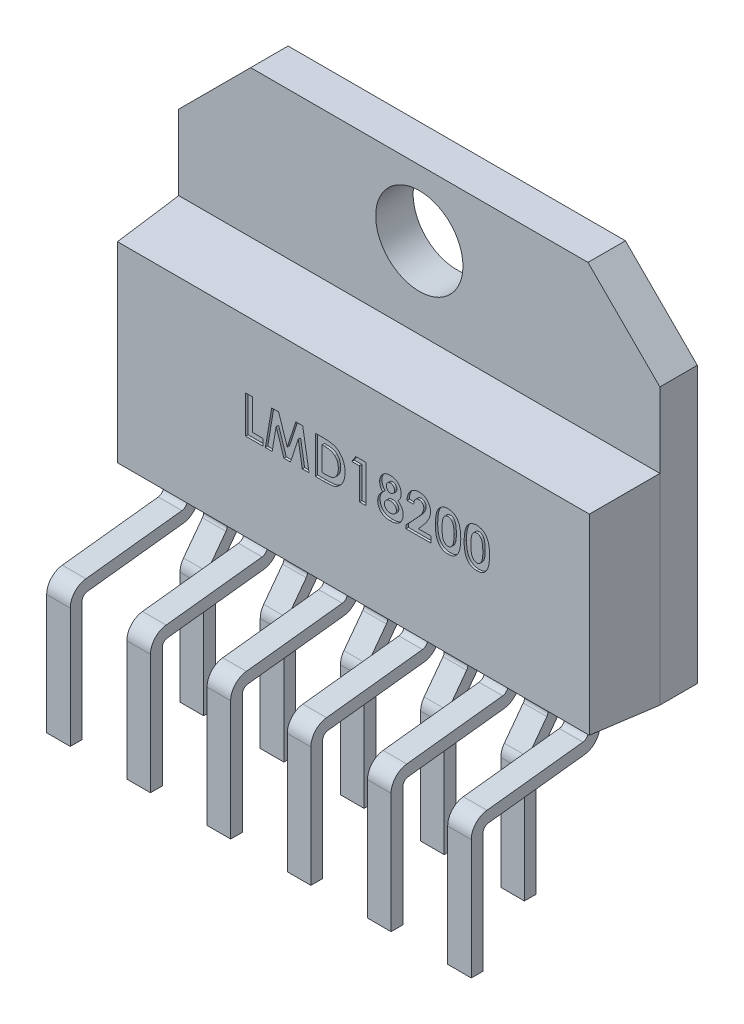
from build123d import *

# Parameters (mm, degrees)
SKETCH1_W          = 1.5875
SKETCH1_H          = 14.732
EXTRUDE2_DEPTH     = 10.1981
SKETCH4_R          = 1.85
CUT_EXTRUDE3_DEPTH = 16.783940061
CHAMFER2_SIZE      = 3.048
SKETCH5_W          = 20.3962
SKETCH5_H          = 8.509
EXTRUDE3_DEPTH     = 2.794
EXTRUDE3_TAPER     = 4
SKETCH6_W          = 1
SKETCH6_H          = 0.5
LPATTERN1_COUNT    = 6
LPATTERN1_PITCH    = 3.4
SKETCH9_W          = 1
SKETCH9_H          = 0.5
LPATTERN2_COUNT    = 5
LPATTERN2_PITCH    = 3.4
SKETCH12_R         = 0.217057399
EXTRUDE4_DEPTH     = 2.54
CUT_EXTRUDE4_DEPTH = 0.1


with BuildPart() as part:
    # Sketch1 → Extrude2 (new, symmetric)
    with BuildSketch(Plane(origin=(0, 0, 0), x_dir=(0, 0, -1), z_dir=(1, 0, 0))):
        with Locations((-0.79375, -4.576)):
            Rectangle(SKETCH1_W, SKETCH1_H)
    extrude(amount=EXTRUDE2_DEPTH, both=True)

    # Sketch4 → Cut-Extrude3 (cut, through all)
    with BuildSketch(Plane.XY.offset(1.5875)):
        Circle(SKETCH4_R)
    extrude(amount=-CUT_EXTRUDE3_DEPTH, mode=Mode.SUBTRACT)

    # Chamfer2
    chamfer2_edges = [part.edges().sort_by_distance(p)[0] for p in [
        (10.1981, 2.79, 0.79375),
        (-10.1981, 2.79, 0.79375),
    ]]
    chamfer(chamfer2_edges, length=CHAMFER2_SIZE)

    # Sketch5 → Extrude3 (add)
    with BuildSketch(Plane.XY.offset(1.5875)):
        with Locations((0, -7.6875)):
            Rectangle(SKETCH5_W, SKETCH5_H)
    extrude(amount=EXTRUDE3_DEPTH, taper=EXTRUDE3_TAPER)

    # Sweep1: sweep along a path in Sketch8
    with BuildLine(Plane(origin=(8.6081, 0, 0), x_dir=(0, 0, -1), z_dir=(1, 0, 0))) as sweep1_path:
        Line((-3.29, -11.43), (-3.29, -12.508264466))
        ThreePointArc((-3.29, -12.508264466), (-3.416774273, -12.840984403), (-3.732810227, -13.004983028))
        Line((-3.732810227, -13.004983028), (-7.800189773, -13.473281438))
        ThreePointArc((-7.800189773, -13.473281438), (-8.116225727, -13.637280063), (-8.243, -13.97))
        Line((-8.243, -13.97), (-8.243, -19.05))
    # Sketch6 → Sweep1 (sweep)
    with BuildSketch(Plane(origin=(0, -11.43, 0), x_dir=(-1, 0, 0), z_dir=(0, 1, 0))):
        with Locations((-8.6081, 3.29)):
            Rectangle(SKETCH6_W, SKETCH6_H)
    sweep1 = sweep(path=sweep1_path.line)

    # LPattern1: Sweep1 ×6
    with Locations(*[(-i * LPATTERN1_PITCH, 0, 0) for i in range(1, LPATTERN1_COUNT)]):
        add(sweep1)

    # Sweep2: sweep along a path in Sketch10
    with BuildLine(Plane(origin=(6.9081, 0, 0), x_dir=(0, 0, -1), z_dir=(1, 0, 0))) as sweep2_path:
        Line((-3.29, -11.43), (-3.29, -12.605732128))
        ThreePointArc((-3.29, -12.605732128), (-3.315412654, -12.763107003), (-3.389067405, -12.904484625))
        Line((-3.389067405, -12.904484625), (-4.190932595, -13.980605812))
        ThreePointArc((-4.190932595, -13.980605812), (-4.264587346, -14.121983434), (-4.29, -14.279358308))
        Line((-4.29, -14.279358308), (-4.29, -19.05))
    # Sketch9 → Sweep2 (sweep)
    with BuildSketch(Plane(origin=(0, -11.43, 0), x_dir=(-1, 0, 0), z_dir=(0, 1, 0))):
        with Locations((-6.9081, 3.29)):
            Rectangle(SKETCH9_W, SKETCH9_H)
    sweep2 = sweep(path=sweep2_path.line)

    # LPattern2: Sweep2 ×5
    with Locations(*[(-i * LPATTERN2_PITCH, 0, 0) for i in range(1, LPATTERN2_COUNT)]):
        add(sweep2)

    # Sketch12 → Extrude4 (cut)
    with BuildSketch(Plane.XZ.offset(19.05)):
        with Locations(Location((0.1081, 4.29, 0), (0, 0, 270))):
            Circle(SKETCH12_R)
    extrude(amount=-EXTRUDE4_DEPTH, mode=Mode.SUBTRACT)

    # Sketch11 → Cut-Extrude4 (cut)
    # profile 1 of 8: a face of its own
    with BuildSketch(Plane.XY.offset(4.3815)):
        Polygon((-4.566807575, -6.464375318), (-4.281871678, -6.464375318), (-4.281871678, -7.766939421), (-3.834115268, -7.766939421), (-3.834115268, -8.051875318), (-4.566807575, -8.051875318), align=None)
    # profile 2 of 8: a face of its own
    with BuildSketch(Plane.XY.offset(4.3815)):
        Polygon((-3.464271017, -6.464375318), (-3.16852282, -6.464375318), (-2.80631078, -7.571682009), (-2.441554671, -6.464375318), (-2.148668553, -6.464375318), (-1.880269114, -8.051875318), (-2.168703108, -8.051875318), (-2.338201806, -7.049193527), (-2.668294955, -8.051875318), (-2.946234659, -8.051875318), (-3.274419755, -7.049193527), (-3.443600444, -8.051875318), (-3.732352447, -8.051875318), align=None)
    # profile 3 of 8: a face of its own
    with BuildSketch(Plane.XY.offset(4.3815)):
        with BuildLine():
            Line((-1.61568578, -6.464375318), (-1.256653829, -6.464375318))
            add(Edge.make_bspline(
                [(-1.256653829, -6.464375318), (-1.228663159, -6.464570983), (-1.174556877, -6.464949204), (-1.096167579, -6.46921085), (-1.023275506, -6.475764959), (-0.955833672, -6.484781323), (-0.893980343, -6.496712443), (-0.837795278, -6.511677694), (-0.787089906, -6.528952586), (-0.741308254, -6.549280002), (-0.699514008, -6.572979751), (-0.659829038, -6.599379368), (-0.622331264, -6.629445949), (-0.586494465, -6.66259945), (-0.55278112, -6.699446403), (-0.520629784, -6.73937649), (-0.490827665, -6.782968752), (-0.462473912, -6.829177983), (-0.436831714, -6.878200015), (-0.414465632, -6.929617582), (-0.395729428, -6.983099793), (-0.380505293, -7.038703645), (-0.3683699, -7.096244552), (-0.359879011, -7.155838625), (-0.354629858, -7.217430689), (-0.354097375, -7.259174656), (-0.353826806, -7.280385935)],
                knots=[0, 0, 0, 0, 1.44355588, 2.790409838, 4.047694926, 5.217575253, 6.298404546, 7.294384826, 8.214239204, 9.058592145, 9.873746385, 10.689560431, 11.514393297, 12.350027578, 13.205127629, 14.088021785, 14.991911688, 15.926770944, 16.882954281, 17.842803888, 18.816321264, 19.80318086, 20.814351908, 21.847355356, 22.906180909, 24, 24, 24, 24], degree=3))
            add(Edge.make_bspline(
                [(-0.353826806, -7.280385935), (-0.354535303, -7.310316431), (-0.35593002, -7.369236365), (-0.367678338, -7.455700689), (-0.386679346, -7.538585367), (-0.413396489, -7.617242044), (-0.446518595, -7.690970269), (-0.48608666, -7.758469878), (-0.531520522, -7.819378565), (-0.582290877, -7.873393055), (-0.637262805, -7.919819242), (-0.694389724, -7.959579874), (-0.754228154, -7.99093445), (-0.806954173, -8.010817939), (-0.85267421, -8.02318375), (-0.892815907, -8.030492063), (-0.93841278, -8.037194227), (-0.989889979, -8.042373515), (-1.047021685, -8.046992167), (-1.110035625, -8.049501763), (-1.178727779, -8.051586864), (-1.226440975, -8.051776647), (-1.251247679, -8.051875318)],
                knots=[0, 0, 0, 0, 1.315458931, 2.589557908, 3.828601765, 5.048913369, 6.235739168, 7.376350998, 8.481830359, 9.569842114, 10.627874879, 11.640079404, 12.624025415, 13.590060155, 14.111227486, 14.704434459, 15.382649715, 16.137166398, 16.978595427, 17.902333227, 18.909396075, 20, 20, 20, 20], degree=3))
            Line((-1.251247679, -8.051875318), (-1.61568578, -8.051875318))
            Line((-1.61568578, -8.051875318), (-1.61568578, -6.464375318))
        make_face()
        with BuildLine():
            Line((-1.330749883, -6.749311216), (-1.330749883, -7.766939421))
            Line((-1.330749883, -7.766939421), (-1.181921758, -7.766939421))
            add(Edge.make_bspline(
                [(-1.181921758, -7.766939421), (-1.164213497, -7.766906972), (-1.130154615, -7.766844562), (-1.0809813, -7.763871921), (-1.035508452, -7.76088821), (-0.993861246, -7.755225025), (-0.955736589, -7.748916636), (-0.921658212, -7.740137649), (-0.890923612, -7.730916067), (-0.863908206, -7.71917585), (-0.839164296, -7.705961454), (-0.816254261, -7.690479257), (-0.794139663, -7.673286862), (-0.773233953, -7.653878615), (-0.753458006, -7.632511518), (-0.734928831, -7.609075476), (-0.717399111, -7.583641993), (-0.701318801, -7.556076595), (-0.686624528, -7.526670381), (-0.673589062, -7.49570819), (-0.662780736, -7.462932177), (-0.653797518, -7.428649162), (-0.64737799, -7.392560674), (-0.642067055, -7.354934015), (-0.639329113, -7.315620112), (-0.638953347, -7.288869618), (-0.638762703, -7.275297794)],
                knots=[0, 0, 0, 0, 1.50275155, 2.890291501, 4.180787663, 5.369391935, 6.45668281, 7.458360028, 8.354766181, 9.177074746, 9.954075863, 10.732690366, 11.5210699, 12.329727389, 13.151100085, 13.990027547, 14.863562427, 15.770965086, 16.696477834, 17.652329173, 18.619756807, 19.62365428, 20.657822005, 21.729286259, 22.847956731, 24, 24, 24, 24], degree=3))
            add(Edge.make_bspline(
                [(-0.638762703, -7.275297794), (-0.639142402, -7.254500258), (-0.639882784, -7.213946672), (-0.647022868, -7.154879491), (-0.658645564, -7.09925889), (-0.675230032, -7.047291294), (-0.696135267, -6.998830647), (-0.722303041, -6.954287512), (-0.752607195, -6.912913626), (-0.776570894, -6.888642377), (-0.788544855, -6.876514741)],
                knots=[0, 0, 0, 0, 1.13821349, 2.219428113, 3.251817212, 4.244760574, 5.201143372, 6.134805572, 7.068016741, 8, 8, 8, 8], degree=3))
            add(Edge.make_bspline(
                [(-0.788544855, -6.876514741), (-0.800352314, -6.866180357), (-0.824467713, -6.845073546), (-0.866806429, -6.819782189), (-0.913461502, -6.797561253), (-0.965500258, -6.779942529), (-1.022419768, -6.76600889), (-1.084559044, -6.756399201), (-1.151585318, -6.750224116), (-1.198019559, -6.749622035), (-1.221990868, -6.749311216)],
                knots=[0, 0, 0, 0, 0.813307809, 1.661089106, 2.549956539, 3.493439533, 4.508053171, 5.589449661, 6.755572447, 8, 8, 8, 8], degree=3))
            Line((-1.221990868, -6.749311216), (-1.330749883, -6.749311216))
        make_face(mode=Mode.SUBTRACT)
    # profile 4 of 8: a face of its own
    with BuildSketch(Plane.XY.offset(4.3815)):
        Polygon((0.101243807, -6.464375318), (0.541686015, -6.464375318), (0.541686015, -8.051875318), (0.256750117, -8.051875318), (0.256750117, -6.728958652), (-0.068890909, -6.728958652), align=None)
    # profile 5 of 8: a face of its own
    with BuildSketch(Plane.XY.offset(4.3815)):
        with BuildLine():
            add(Edge.make_bspline(
                [(1.891315422, -7.197067626), (1.907962359, -7.208962312), (1.940913469, -7.23250677), (1.984429831, -7.274687548), (2.021912591, -7.321740694), (2.052968137, -7.373377595), (2.077848904, -7.428329002), (2.095659758, -7.48600755), (2.106973009, -7.5459045), (2.108208753, -7.586684014), (2.10883345, -7.607298996)],
                knots=[0, 0, 0, 0, 1.013736912, 2.006600758, 2.994453809, 3.989973287, 4.987781207, 5.978959008, 6.978317308, 8, 8, 8, 8], degree=3))
            add(Edge.make_bspline(
                [(2.10883345, -7.607298996), (2.108079801, -7.629621393), (2.106585033, -7.673895003), (2.09336929, -7.738822244), (2.072151945, -7.801198598), (2.043154302, -7.860335588), (2.006796591, -7.914395461), (1.964418297, -7.962253855), (1.915966, -8.002660865), (1.870855539, -8.030076761), (1.832027389, -8.048288622), (1.800693413, -8.059943848), (1.767606794, -8.070204643), (1.73253143, -8.078402338), (1.6954737, -8.084801984), (1.656486489, -8.089028298), (1.615544134, -8.092100571), (1.587623178, -8.092417791), (1.573306607, -8.092580446)],
                knots=[0, 0, 0, 0, 1.313679292, 2.605514271, 3.884962679, 5.186178731, 6.472827995, 7.711026938, 8.938935107, 10.174644318, 10.808706728, 11.462743532, 12.142127587, 12.847854939, 13.582806024, 14.355735269, 15.156897313, 16, 16, 16, 16], degree=3))
            add(Edge.make_bspline(
                [(1.573306607, -8.092580446), (1.558039405, -8.092373353), (1.528225569, -8.091968942), (1.484704008, -8.089523654), (1.44365032, -8.085015491), (1.404978386, -8.079080844), (1.368725414, -8.071227586), (1.334890328, -8.061270085), (1.303391432, -8.049932362), (1.264835128, -8.032669706), (1.220772265, -8.005710372), (1.173148278, -7.966229204), (1.131346602, -7.9192059), (1.095004003, -7.865960397), (1.066357397, -7.80682026), (1.045054927, -7.743641707), (1.032439352, -7.676595943), (1.030920578, -7.630672891), (1.030147553, -7.607298996)],
                knots=[0, 0, 0, 0, 0.886964665, 1.7320671, 2.531131818, 3.285397207, 4.004107883, 4.684213108, 5.332925796, 5.947568694, 7.135706876, 8.320776993, 9.52873045, 10.778999824, 12.05415135, 13.333578234, 14.642845846, 16, 16, 16, 16], degree=3))
            add(Edge.make_bspline(
                [(1.030147553, -7.607298996), (1.030853968, -7.586909118), (1.03224216, -7.54684054), (1.042185964, -7.4881274), (1.059236566, -7.432460396), (1.082632645, -7.379451998), (1.112801493, -7.329096306), (1.14992151, -7.281763841), (1.193522051, -7.237027596), (1.226585156, -7.210608558), (1.243531467, -7.197067626)],
                knots=[0, 0, 0, 0, 1.01821053, 2.000906977, 2.963938143, 3.919209931, 4.888045165, 5.887808425, 6.917407893, 8, 8, 8, 8], degree=3))
            add(Edge.make_bspline(
                [(1.243531467, -7.197067626), (1.233025653, -7.184950706), (1.212342869, -7.16109614), (1.185579142, -7.122704118), (1.163031829, -7.083121902), (1.143888088, -7.042670724), (1.129736546, -7.000654115), (1.119034717, -6.957732663), (1.112981774, -6.913469096), (1.11203568, -6.883634136), (1.111557809, -6.868564521)],
                knots=[0, 0, 0, 0, 1.061529281, 2.089831458, 3.092927091, 4.075998741, 5.048384512, 6.024008542, 7.00192825, 8, 8, 8, 8], degree=3))
            add(Edge.make_bspline(
                [(1.111557809, -6.868564521), (1.112191394, -6.848164705), (1.113441431, -6.807916654), (1.124512939, -6.7490645), (1.142894332, -6.693143224), (1.167900652, -6.640316555), (1.199654792, -6.591735794), (1.237385585, -6.548169711), (1.281623451, -6.511214115), (1.330723304, -6.479504583), (1.384931255, -6.454283115), (1.443732985, -6.436635021), (1.506418453, -6.425462847), (1.549619407, -6.424276833), (1.571716563, -6.42367019)],
                knots=[0, 0, 0, 0, 1.022455555, 2.017265428, 2.990720743, 3.968117071, 4.939886797, 5.893155559, 6.847550415, 7.820889576, 8.817530429, 9.83499769, 10.892607882, 12, 12, 12, 12], degree=3))
            add(Edge.make_bspline(
                [(1.571716563, -6.42367019), (1.593495463, -6.424277825), (1.635959758, -6.425462587), (1.697543613, -6.436560735), (1.755074626, -6.454601943), (1.808077057, -6.480355949), (1.856669122, -6.512126598), (1.900155132, -6.550368953), (1.937767525, -6.59502012), (1.969785245, -6.644857651), (1.995298447, -6.69855037), (2.014160267, -6.754858332), (2.025070167, -6.813338952), (2.026635715, -6.853044534), (2.027423194, -6.873016644)],
                knots=[0, 0, 0, 0, 1.094655142, 2.134348324, 3.136019022, 4.118575226, 5.088726318, 6.048298823, 7.020513804, 8.015920439, 9.020015034, 10.003048569, 10.995523219, 12, 12, 12, 12], degree=3))
            add(Edge.make_bspline(
                [(2.027423194, -6.873016644), (2.027043847, -6.887131852), (2.026299406, -6.914831892), (2.020795159, -6.955641868), (2.011526683, -6.994799095), (1.998604329, -7.033249842), (1.980637847, -7.07203903), (1.956325018, -7.11190993), (1.926751654, -7.154519186), (1.903526214, -7.182406074), (1.891315422, -7.197067626)],
                knots=[0, 0, 0, 0, 0.940746401, 1.846144481, 2.739104268, 3.619506754, 4.545839139, 5.581956076, 6.728711598, 8, 8, 8, 8], degree=3))
        make_face()
        with BuildLine():
            add(Edge.make_bspline(
                [(1.56472037, -6.708606087), (1.552988964, -6.70917165), (1.530168787, -6.710271794), (1.497607068, -6.720201809), (1.468333019, -6.736443055), (1.44301488, -6.758794206), (1.422252686, -6.785913979), (1.406993614, -6.8170937), (1.397944804, -6.851948576), (1.396986812, -6.876354621), (1.396493707, -6.888917085)],
                knots=[0, 0, 0, 0, 1.018099191, 1.980427864, 2.929421084, 3.909248076, 4.895556904, 5.880788387, 6.909183412, 8, 8, 8, 8], degree=3))
            add(Edge.make_bspline(
                [(1.396493707, -6.888917085), (1.397102842, -6.901586835), (1.398292238, -6.926325742), (1.407645502, -6.961850294), (1.423588397, -6.99404564), (1.445477885, -7.022239326), (1.472077157, -7.045267114), (1.501860188, -7.062854456), (1.535157276, -7.072894614), (1.558295558, -7.074256095), (1.570126519, -7.074952241)],
                knots=[0, 0, 0, 0, 1.07118507, 2.091592095, 3.082435519, 4.092579768, 5.090825648, 6.043203473, 6.999459622, 8, 8, 8, 8], degree=3))
            add(Edge.make_bspline(
                [(1.570126519, -7.074952241), (1.582181152, -7.074412847), (1.605665837, -7.073362006), (1.639046064, -7.063061335), (1.669117383, -7.046587509), (1.694869024, -7.023297165), (1.716199294, -6.995093269), (1.731733637, -6.96233528), (1.740674644, -6.92563868), (1.7418683, -6.899991125), (1.742487297, -6.886691023)],
                knots=[0, 0, 0, 0, 1.008803858, 1.965339183, 2.900766489, 3.864508618, 4.855158575, 5.849593072, 6.884859315, 8, 8, 8, 8], degree=3))
            add(Edge.make_bspline(
                [(1.742487297, -6.886691023), (1.741852642, -6.874136864), (1.740625242, -6.849857562), (1.731824317, -6.815000425), (1.715660977, -6.784307345), (1.694424434, -6.75735598), (1.6677995, -6.73562138), (1.636889902, -6.719637625), (1.601923245, -6.710366892), (1.577389872, -6.709205732), (1.56472037, -6.708606087)],
                knots=[0, 0, 0, 0, 1.065910571, 2.061433587, 3.023559535, 3.990682701, 4.956464619, 5.918590567, 6.925120432, 8, 8, 8, 8], degree=3))
        make_face(mode=Mode.SUBTRACT)
        with BuildLine():
            add(Edge.make_bspline(
                [(1.573942625, -7.359888139), (1.565027645, -7.360036185), (1.547456329, -7.360327983), (1.521625052, -7.36369285), (1.496837287, -7.368707334), (1.473123787, -7.375624674), (1.450604352, -7.385054748), (1.429088091, -7.396422876), (1.408649311, -7.409843977), (1.389591178, -7.425074389), (1.372367079, -7.441791218), (1.35684112, -7.459226328), (1.344150841, -7.477830465), (1.333582864, -7.496985221), (1.325091435, -7.516842387), (1.319477958, -7.53772897), (1.315863665, -7.559366819), (1.315345052, -7.574105645), (1.31508345, -7.581540282)],
                knots=[0, 0, 0, 0, 1.129580664, 2.226389355, 3.296443603, 4.333934503, 5.352185725, 6.386189251, 7.41493955, 8.447544828, 9.47401038, 10.455044306, 11.4018853, 12.322125673, 13.225630306, 14.132028716, 15.057747923, 16, 16, 16, 16], degree=3))
            add(Edge.make_bspline(
                [(1.31508345, -7.581540282), (1.315208134, -7.589293875), (1.31545543, -7.604672166), (1.319190478, -7.627118025), (1.324568288, -7.648765514), (1.332121595, -7.669412), (1.342222706, -7.689045463), (1.354283617, -7.707856782), (1.368724887, -7.725714049), (1.385154944, -7.742521521), (1.403548319, -7.75768486), (1.423372348, -7.771044026), (1.444365198, -7.782822151), (1.467157061, -7.791305222), (1.490903864, -7.799069675), (1.516241789, -7.803780182), (1.542894091, -7.807246303), (1.561103659, -7.807509525), (1.570444528, -7.807644549)],
                knots=[0, 0, 0, 0, 0.973817353, 1.931446211, 2.852767904, 3.776304432, 4.688323523, 5.623710549, 6.581246645, 7.570897993, 8.57436511, 9.572506873, 10.574556662, 11.591826551, 12.624694332, 13.712108235, 14.826391851, 16, 16, 16, 16], degree=3))
            add(Edge.make_bspline(
                [(1.570444528, -7.807644549), (1.579886757, -7.807473397), (1.598286671, -7.807139877), (1.625183645, -7.80419219), (1.650623408, -7.799515067), (1.674575575, -7.792825692), (1.697130721, -7.784256337), (1.717986288, -7.773349243), (1.737618443, -7.76098847), (1.755396305, -7.746547391), (1.771628803, -7.730809629), (1.78561538, -7.713562381), (1.79750801, -7.695360254), (1.807100713, -7.676006577), (1.814841163, -7.655592704), (1.820150625, -7.63391509), (1.823445338, -7.611217339), (1.823745196, -7.595756196), (1.823897553, -7.587900458)],
                knots=[0, 0, 0, 0, 1.200705402, 2.339794563, 3.437264955, 4.487414319, 5.499029866, 6.500076882, 7.476298407, 8.444948224, 9.407950986, 10.347155707, 11.263432813, 12.167927724, 13.089546445, 14.03463663, 15.00140776, 16, 16, 16, 16], degree=3))
            add(Edge.make_bspline(
                [(1.823897553, -7.587900458), (1.823606642, -7.579942019), (1.823038011, -7.564386027), (1.819926546, -7.541413947), (1.814089755, -7.519636056), (1.806453528, -7.49854727), (1.796295593, -7.478583986), (1.783684736, -7.459788337), (1.769330486, -7.441694732), (1.752553538, -7.425108633), (1.734210555, -7.409943043), (1.714687373, -7.396432167), (1.694044126, -7.384989701), (1.672224348, -7.375636054), (1.649148315, -7.368703735), (1.624992097, -7.363693026), (1.599795319, -7.36032723), (1.582645908, -7.360035958), (1.573942625, -7.359888139)],
                knots=[0, 0, 0, 0, 1.011708178, 1.977538892, 2.938094892, 3.871441737, 4.823268678, 5.775953079, 6.743660653, 7.753304209, 8.767430709, 9.76505158, 10.765940967, 11.761741361, 12.775867861, 13.822051386, 14.89469657, 16, 16, 16, 16], degree=3))
        make_face(mode=Mode.SUBTRACT)
    # profile 6 of 8: a face of its own
    with BuildSketch(Plane.XY.offset(4.3815)):
        with BuildLine():
            Line((2.556589861, -6.993541985), (2.271653963, -6.993541985))
            add(Edge.make_bspline(
                [(2.271653963, -6.993541985), (2.272884558, -6.971988092), (2.275289065, -6.929873078), (2.284853589, -6.868699673), (2.297669723, -6.810897532), (2.314774554, -6.756668853), (2.336267894, -6.706033342), (2.361596664, -6.658818379), (2.391407955, -6.615272552), (2.425067286, -6.575605863), (2.462003214, -6.54002051), (2.501448913, -6.508468301), (2.544007758, -6.482432212), (2.588902163, -6.461006921), (2.636124485, -6.44388911), (2.68612152, -6.432444467), (2.738460367, -6.424694043), (2.774290547, -6.42401585), (2.792552401, -6.42367019)],
                knots=[0, 0, 0, 0, 1.199038563, 2.342849363, 3.436047546, 4.486744587, 5.497670872, 6.488682221, 7.459191391, 8.424610317, 9.374430501, 10.305433194, 11.225809216, 12.140057399, 13.06607119, 14.010487599, 14.985989317, 16, 16, 16, 16], degree=3))
            add(Edge.make_bspline(
                [(2.792552401, -6.42367019), (2.814968567, -6.424369634), (2.858730178, -6.425735111), (2.922319268, -6.437383088), (2.981704527, -6.45686613), (3.036842785, -6.484089077), (3.087264641, -6.518672979), (3.132961734, -6.559908621), (3.172552111, -6.608661149), (3.206286787, -6.66290205), (3.234316271, -6.720335531), (3.253958165, -6.779724132), (3.266868571, -6.839491921), (3.268245546, -6.879736524), (3.268929604, -6.899729385)],
                knots=[0, 0, 0, 0, 1.075374347, 2.099382735, 3.09057751, 4.06680945, 5.040638231, 6.016817125, 7.011024321, 8.044445721, 9.0776792, 10.070479129, 11.0414456, 12, 12, 12, 12], degree=3))
            add(Edge.make_bspline(
                [(3.268929604, -6.899729385), (3.268663268, -6.91182248), (3.268127199, -6.936162893), (3.264399839, -6.972995912), (3.258808063, -7.010514649), (3.250377028, -7.048686934), (3.239862835, -7.087523467), (3.2271076, -7.127140474), (3.211815452, -7.167313339), (3.194241586, -7.208494203), (3.17327592, -7.250816763), (3.148864315, -7.29491545), (3.120358833, -7.340751146), (3.088103784, -7.388582653), (3.051942513, -7.438334535), (3.011698493, -7.489856924), (2.96783524, -7.543331366), (2.936704255, -7.57907603), (2.920709953, -7.597440723)],
                knots=[0, 0, 0, 0, 0.728284026, 1.46585585, 2.227944881, 3.01186502, 3.81876927, 4.650621989, 5.517437689, 6.406905708, 7.346299482, 8.360816762, 9.441613733, 10.596154504, 11.834900912, 13.145207542, 14.533280747, 16, 16, 16, 16], degree=3))
            Line((2.920709953, -7.597440723), (2.755027361, -7.787291985))
            Line((2.755027361, -7.787291985), (3.289282168, -7.787291985))
            Line((3.289282168, -7.787291985), (3.289282168, -8.051875318))
            Line((3.289282168, -8.051875318), (2.230948835, -8.051875318))
            Line((2.230948835, -8.051875318), (2.230948835, -7.907499317))
            Line((2.230948835, -7.907499317), (2.700965862, -7.407271452))
            add(Edge.make_bspline(
                [(2.700965862, -7.407271452), (2.714574063, -7.39267965), (2.740929112, -7.364419656), (2.778429632, -7.322916849), (2.812364289, -7.283531676), (2.842029421, -7.245844764), (2.868981817, -7.211078524), (2.892019671, -7.178185056), (2.911353762, -7.147461731), (2.932343659, -7.110414767), (2.952277162, -7.066229669), (2.970567357, -7.015326625), (2.981716497, -6.966675038), (2.98325543, -6.934972618), (2.983993707, -6.91976394)],
                knots=[0, 0, 0, 0, 1.246127091, 2.413378631, 3.493388633, 4.492180848, 5.408488754, 6.240484944, 6.999099869, 7.674939598, 8.898438119, 10.020720584, 11.050475521, 12, 12, 12, 12], degree=3))
            add(Edge.make_bspline(
                [(2.983993707, -6.91976394), (2.983441715, -6.905050717), (2.982372143, -6.876541489), (2.970618414, -6.835987264), (2.95240913, -6.799269553), (2.926749676, -6.767485522), (2.895668041, -6.741366477), (2.859750292, -6.721939865), (2.819289265, -6.710730799), (2.790925314, -6.709327824), (2.776333951, -6.708606087)],
                knots=[0, 0, 0, 0, 1.062038974, 2.057870785, 3.028805853, 4.01125022, 4.991535629, 5.949134679, 6.94496649, 8, 8, 8, 8], degree=3))
            add(Edge.make_bspline(
                [(2.776333951, -6.708606087), (2.768795868, -6.708872706), (2.753955939, -6.709397587), (2.732142405, -6.712891577), (2.71138526, -6.719049369), (2.691453465, -6.727299945), (2.672559739, -6.738236142), (2.654751736, -6.751716747), (2.637841828, -6.767399187), (2.621907569, -6.785234426), (2.607405313, -6.805138558), (2.594524463, -6.826929799), (2.583874144, -6.850594624), (2.574497216, -6.875820619), (2.567265281, -6.902878733), (2.561999535, -6.931607027), (2.55799634, -6.961958762), (2.557067216, -6.982822726), (2.556589861, -6.993541985)],
                knots=[0, 0, 0, 0, 0.903469896, 1.778625579, 2.63899355, 3.493148037, 4.358286772, 5.247621495, 6.164656832, 7.118446693, 8.109501108, 9.111810964, 10.146451449, 11.215617525, 12.33435995, 13.498009769, 14.714554818, 16, 16, 16, 16], degree=3))
        make_face()
    # profile 7 of 8: a face of its own
    with BuildSketch(Plane.XY.offset(4.3815)):
        with BuildLine():
            add(Edge.make_bspline(
                [(4.007028062, -6.42367019), (4.020820142, -6.423874937), (4.047939056, -6.424277525), (4.087880112, -6.42863788), (4.126354392, -6.435225161), (4.163512413, -6.44441212), (4.199086706, -6.456570734), (4.233336189, -6.471124386), (4.265853194, -6.488836446), (4.297052416, -6.508843126), (4.326921839, -6.531493525), (4.35474357, -6.55731615), (4.381025695, -6.58571682), (4.405199301, -6.617124902), (4.427799721, -6.651254708), (4.448752693, -6.688111649), (4.467897818, -6.727876115), (4.485449666, -6.770619864), (4.501144584, -6.816983607), (4.514364394, -6.867499155), (4.525702593, -6.922178045), (4.535272833, -6.981156381), (4.542506388, -7.044512559), (4.54738195, -7.112204489), (4.550727791, -7.18410167), (4.551000855, -7.233422545), (4.551141143, -7.258761336)],
                knots=[0, 0, 0, 0, 0.879237366, 1.728815576, 2.559023295, 3.367336655, 4.166867292, 4.954216142, 5.737608147, 6.525189134, 7.316157332, 8.124696809, 8.942788509, 9.781158001, 10.649253743, 11.551476218, 12.482711956, 13.461909668, 14.496590415, 15.601789533, 16.789733467, 18.056700938, 19.410929216, 20.8549011, 22.384193279, 24, 24, 24, 24], degree=3))
            add(Edge.make_bspline(
                [(4.551141143, -7.258761336), (4.55098953, -7.284417143), (4.550694948, -7.334265916), (4.547521037, -7.406820705), (4.542055413, -7.475004119), (4.535010923, -7.538809103), (4.525361898, -7.598201963), (4.514061548, -7.653336487), (4.500633067, -7.70419269), (4.484421163, -7.750655981), (4.466975557, -7.793474798), (4.447778062, -7.833161732), (4.427163289, -7.86982428), (4.405604077, -7.904015543), (4.381918472, -7.934727583), (4.357259319, -7.963004768), (4.330552914, -7.987769985), (4.302923701, -8.010299521), (4.273359508, -8.029769561), (4.242165225, -8.046797738), (4.208784711, -8.060609611), (4.173826436, -8.072622441), (4.13669453, -8.081246357), (4.097979012, -8.08808915), (4.057242793, -8.091870898), (4.029507935, -8.092340049), (4.015296291, -8.092580446)],
                knots=[0, 0, 0, 0, 1.643780988, 3.193836972, 4.651895693, 6.025988579, 7.305620092, 8.505800249, 9.631074763, 10.672816429, 11.65661981, 12.592235626, 13.49536222, 14.350718032, 15.179365177, 15.97804903, 16.751647189, 17.51006938, 18.259804725, 19.016521909, 19.783502495, 20.571750527, 21.382245291, 22.22305063, 23.089471752, 24, 24, 24, 24], degree=3))
            add(Edge.make_bspline(
                [(4.015296291, -8.092580446), (4.00108503, -8.092335411), (3.97324538, -8.091855391), (3.932399007, -8.088117269), (3.893478317, -8.081218636), (3.856052637, -8.072556233), (3.820382445, -8.060636191), (3.786296702, -8.046411076), (3.7540575, -8.029489147), (3.723575572, -8.009973743), (3.694954992, -7.987594947), (3.667750997, -7.962592124), (3.642023764, -7.93502865), (3.618164667, -7.904595793), (3.595782964, -7.871699766), (3.575112061, -7.835964913), (3.55616438, -7.797443264), (3.538347233, -7.756081122), (3.522866389, -7.71098801), (3.509089156, -7.66176125), (3.497803209, -7.607990497), (3.488726295, -7.549693026), (3.481479293, -7.486992343), (3.476088356, -7.419858183), (3.472896815, -7.348259277), (3.472605323, -7.299045782), (3.472455245, -7.27370775)],
                knots=[0, 0, 0, 0, 0.917216111, 1.796812873, 2.643793957, 3.46689424, 4.273913431, 5.068098542, 5.848489301, 6.620921603, 7.401012384, 8.190319798, 9.003608147, 9.831726257, 10.68377682, 11.569763213, 12.493818149, 13.453288342, 14.474581811, 15.568529029, 16.750744269, 18.018426408, 19.375425659, 20.823733699, 22.36466933, 24, 24, 24, 24], degree=3))
            add(Edge.make_bspline(
                [(3.472455245, -7.27370775), (3.472727097, -7.238502549), (3.473251638, -7.170573661), (3.479899009, -7.072436168), (3.489655663, -6.981725055), (3.503985877, -6.898592061), (3.521704988, -6.822729284), (3.544395232, -6.754636469), (3.570226425, -6.693371399), (3.59223792, -6.657077602), (3.602838859, -6.639598175)],
                knots=[0, 0, 0, 0, 1.288568992, 2.486310467, 3.599230591, 4.627010532, 5.572937695, 6.447898582, 7.252493626, 8, 8, 8, 8], degree=3))
            add(Edge.make_bspline(
                [(3.602838859, -6.639598175), (3.615165126, -6.622426391), (3.639265407, -6.588852169), (3.681405422, -6.544775492), (3.726679382, -6.50707896), (3.776017187, -6.476615678), (3.828638541, -6.452592332), (3.884995223, -6.435624912), (3.944879119, -6.425738903), (3.986002389, -6.424370059), (4.007028062, -6.42367019)],
                knots=[0, 0, 0, 0, 1.058512271, 2.069600068, 3.047294572, 4.004278952, 4.967380941, 5.939006123, 6.946246673, 8, 8, 8, 8], degree=3))
        make_face()
        with BuildLine():
            add(Edge.make_bspline(
                [(4.014024256, -6.708606087), (4.001556101, -6.709197053), (3.977111899, -6.71035566), (3.941642198, -6.720190595), (3.908196484, -6.735381182), (3.882755223, -6.75366068), (3.863712692, -6.77118377), (3.850407539, -6.787041596), (3.837576816, -6.804737788), (3.826244075, -6.825070883), (3.815543009, -6.847310288), (3.805084843, -6.871556959), (3.796511893, -6.898406445), (3.788089196, -6.927401495), (3.780710128, -6.959343747), (3.774528087, -6.994494293), (3.769004976, -7.03308172), (3.765152541, -7.075131303), (3.761560915, -7.120599048), (3.758986267, -7.169586238), (3.757909872, -7.22207966), (3.757567718, -7.2582311), (3.757391143, -7.276887838)],
                knots=[0, 0, 0, 0, 1.076674018, 2.110852608, 3.161083442, 4.239746716, 4.804137807, 5.395870207, 6.026861976, 6.692161227, 7.405688833, 8.16177676, 8.973626916, 9.841385931, 10.773283133, 11.807421078, 12.927755683, 14.143907515, 15.458935494, 16.872852025, 18.386167141, 20, 20, 20, 20], degree=3))
            add(Edge.make_bspline(
                [(3.757391143, -7.276887838), (3.757681765, -7.301058545), (3.758239055, -7.347407667), (3.761157877, -7.414059318), (3.767008414, -7.474717688), (3.774285302, -7.529793881), (3.784505987, -7.578930712), (3.796265547, -7.622593061), (3.810787558, -7.660224341), (3.82757054, -7.692368783), (3.846158449, -7.719713993), (3.866336441, -7.742957545), (3.887417529, -7.763085364), (3.910059722, -7.779434944), (3.934209003, -7.791964508), (3.959663768, -7.800976868), (3.986440195, -7.80649371), (4.004776416, -7.807258718), (4.014024256, -7.807644549)],
                knots=[0, 0, 0, 0, 1.771748488, 3.397459088, 4.888034009, 6.237357457, 7.467047327, 8.564189669, 9.548206622, 10.417051504, 11.216568818, 11.965764335, 12.669334354, 13.348544111, 14.005342236, 14.656555988, 15.322436492, 16, 16, 16, 16], degree=3))
            add(Edge.make_bspline(
                [(4.014024256, -7.807644549), (4.022954739, -7.807380535), (4.040439513, -7.806863628), (4.065936231, -7.801557652), (4.090047739, -7.792931287), (4.112701237, -7.780728688), (4.133977753, -7.765211216), (4.153773302, -7.746310681), (4.171938588, -7.723838688), (4.182521766, -7.707161146), (4.187975077, -7.698567526)],
                knots=[0, 0, 0, 0, 0.992283464, 1.942767638, 2.88273346, 3.832339453, 4.79467288, 5.803907806, 6.868395428, 8, 8, 8, 8], degree=3))
            add(Edge.make_bspline(
                [(4.187975077, -7.698567526), (4.194395432, -7.686824618), (4.207858395, -7.662200693), (4.22343776, -7.620648738), (4.236551601, -7.573785), (4.247838492, -7.521463635), (4.255558037, -7.463478281), (4.2622061, -7.400196628), (4.265412625, -7.331300016), (4.265934184, -7.283568194), (4.266205245, -7.258761336)],
                knots=[0, 0, 0, 0, 0.710965849, 1.490837728, 2.352621235, 3.297892224, 4.334225155, 5.461620853, 6.680770821, 8, 8, 8, 8], degree=3))
            add(Edge.make_bspline(
                [(4.266205245, -7.258761336), (4.26610054, -7.233739142), (4.265899001, -7.18557569), (4.262201338, -7.11643139), (4.257052061, -7.053279547), (4.249520154, -6.996261153), (4.239828987, -6.945237794), (4.227884587, -6.900212805), (4.213803028, -6.86109745), (4.197103977, -6.827930732), (4.178608741, -6.799743572), (4.158975483, -6.775561174), (4.138121186, -6.754914854), (4.116080726, -6.737726914), (4.092343967, -6.724594039), (4.067364313, -6.715321143), (4.041090554, -6.709711351), (4.023168131, -6.708979482), (4.014024256, -6.708606087)],
                knots=[0, 0, 0, 0, 1.793836731, 3.452829483, 4.963243077, 6.335886805, 7.574563692, 8.684454726, 9.672768357, 10.54971625, 11.340229787, 12.085688095, 12.778991901, 13.440269426, 14.083255152, 14.715733572, 15.344777694, 16, 16, 16, 16], degree=3))
        make_face(mode=Mode.SUBTRACT)
    # profile 8 of 8: a face of its own
    with BuildSketch(Plane.XY.offset(4.3815)):
        with BuildLine():
            add(Edge.make_bspline(
                [(5.228181908, -6.42367019), (5.241973988, -6.423874937), (5.269092902, -6.424277525), (5.309033959, -6.42863788), (5.347508239, -6.435225161), (5.384666259, -6.44441212), (5.420240552, -6.456570734), (5.454490035, -6.471124386), (5.48700704, -6.488836446), (5.518206263, -6.508843126), (5.548075685, -6.531493525), (5.575897417, -6.55731615), (5.602179541, -6.58571682), (5.626353147, -6.617124902), (5.648953567, -6.651254708), (5.66990654, -6.688111649), (5.689051664, -6.727876115), (5.706603512, -6.770619864), (5.72229843, -6.816983607), (5.73551824, -6.867499155), (5.74685644, -6.922178045), (5.75642668, -6.981156381), (5.763660234, -7.044512559), (5.768535796, -7.112204489), (5.771881637, -7.18410167), (5.772154701, -7.233422545), (5.772294989, -7.258761336)],
                knots=[0, 0, 0, 0, 0.879237366, 1.728815576, 2.559023295, 3.367336655, 4.166867292, 4.954216142, 5.737608147, 6.525189134, 7.316157332, 8.124696809, 8.942788509, 9.781158001, 10.649253743, 11.551476218, 12.482711956, 13.461909668, 14.496590415, 15.601789533, 16.789733467, 18.056700938, 19.410929216, 20.8549011, 22.384193279, 24, 24, 24, 24], degree=3))
            add(Edge.make_bspline(
                [(5.772294989, -7.258761336), (5.772143376, -7.284417143), (5.771848794, -7.334265916), (5.768674883, -7.406820705), (5.763209259, -7.475004119), (5.756164769, -7.538809103), (5.746515744, -7.598201963), (5.735215394, -7.653336487), (5.721786913, -7.70419269), (5.70557501, -7.750655981), (5.688129403, -7.793474798), (5.668931908, -7.833161732), (5.648317135, -7.86982428), (5.626757923, -7.904015543), (5.603072318, -7.934727583), (5.578413165, -7.963004768), (5.55170676, -7.987769985), (5.524077547, -8.010299521), (5.494513354, -8.029769561), (5.463319071, -8.046797738), (5.429938557, -8.060609611), (5.394980282, -8.072622441), (5.357848376, -8.081246357), (5.319132858, -8.08808915), (5.27839664, -8.091870898), (5.250661781, -8.092340049), (5.236450137, -8.092580446)],
                knots=[0, 0, 0, 0, 1.643780988, 3.193836972, 4.651895693, 6.025988579, 7.305620092, 8.505800249, 9.631074763, 10.672816429, 11.65661981, 12.592235626, 13.49536222, 14.350718032, 15.179365177, 15.97804903, 16.751647189, 17.51006938, 18.259804725, 19.016521909, 19.783502495, 20.571750527, 21.382245291, 22.22305063, 23.089471752, 24, 24, 24, 24], degree=3))
            add(Edge.make_bspline(
                [(5.236450137, -8.092580446), (5.222238877, -8.092335411), (5.194399226, -8.091855391), (5.153552853, -8.088117269), (5.114632163, -8.081218636), (5.077206483, -8.072556233), (5.041536291, -8.060636191), (5.007450548, -8.046411076), (4.975211346, -8.029489147), (4.944729418, -8.009973743), (4.916108838, -7.987594947), (4.888904843, -7.962592124), (4.86317761, -7.93502865), (4.839318513, -7.904595793), (4.81693681, -7.871699766), (4.796265907, -7.835964913), (4.777318226, -7.797443264), (4.75950108, -7.756081122), (4.744020235, -7.71098801), (4.730243002, -7.66176125), (4.718957055, -7.607990497), (4.709880141, -7.549693026), (4.702633139, -7.486992343), (4.697242202, -7.419858183), (4.694050662, -7.348259277), (4.693759169, -7.299045782), (4.693609091, -7.27370775)],
                knots=[0, 0, 0, 0, 0.917216111, 1.796812873, 2.643793957, 3.46689424, 4.273913431, 5.068098542, 5.848489301, 6.620921603, 7.401012384, 8.190319798, 9.003608147, 9.831726257, 10.68377682, 11.569763213, 12.493818149, 13.453288342, 14.474581811, 15.568529029, 16.750744269, 18.018426408, 19.375425659, 20.823733699, 22.36466933, 24, 24, 24, 24], degree=3))
            add(Edge.make_bspline(
                [(4.693609091, -7.27370775), (4.693880943, -7.238502549), (4.694405484, -7.170573661), (4.701052855, -7.072436168), (4.710809509, -6.981725055), (4.725139723, -6.898592061), (4.742858834, -6.822729284), (4.765549079, -6.754636469), (4.791380271, -6.693371399), (4.813391766, -6.657077602), (4.823992705, -6.639598175)],
                knots=[0, 0, 0, 0, 1.288568992, 2.486310467, 3.599230591, 4.627010532, 5.572937695, 6.447898582, 7.252493626, 8, 8, 8, 8], degree=3))
            add(Edge.make_bspline(
                [(4.823992705, -6.639598175), (4.836318972, -6.622426391), (4.860419253, -6.588852169), (4.902559268, -6.544775492), (4.947833228, -6.50707896), (4.997171034, -6.476615678), (5.049792387, -6.452592332), (5.106149069, -6.435624912), (5.166032965, -6.425738903), (5.207156235, -6.424370059), (5.228181908, -6.42367019)],
                knots=[0, 0, 0, 0, 1.058512271, 2.069600068, 3.047294572, 4.004278952, 4.967380941, 5.939006123, 6.946246673, 8, 8, 8, 8], degree=3))
        make_face()
        with BuildLine():
            add(Edge.make_bspline(
                [(5.235178102, -6.708606087), (5.222709947, -6.709197053), (5.198265745, -6.71035566), (5.162796044, -6.720190595), (5.12935033, -6.735381182), (5.103909069, -6.75366068), (5.084866538, -6.77118377), (5.071561385, -6.787041596), (5.058730662, -6.804737788), (5.047397921, -6.825070883), (5.036696856, -6.847310288), (5.026238689, -6.871556959), (5.017665739, -6.898406445), (5.009243042, -6.927401495), (5.001863974, -6.959343747), (4.995681933, -6.994494293), (4.990158822, -7.03308172), (4.986306387, -7.075131303), (4.982714761, -7.120599048), (4.980140114, -7.169586238), (4.979063718, -7.22207966), (4.978721565, -7.2582311), (4.978544989, -7.276887838)],
                knots=[0, 0, 0, 0, 1.076674018, 2.110852608, 3.161083442, 4.239746716, 4.804137807, 5.395870207, 6.026861976, 6.692161227, 7.405688833, 8.16177676, 8.973626916, 9.841385931, 10.773283133, 11.807421078, 12.927755683, 14.143907515, 15.458935494, 16.872852025, 18.386167141, 20, 20, 20, 20], degree=3))
            add(Edge.make_bspline(
                [(4.978544989, -7.276887838), (4.978835611, -7.301058545), (4.979392901, -7.347407667), (4.982311723, -7.414059318), (4.988162261, -7.474717688), (4.995439148, -7.529793881), (5.005659833, -7.578930712), (5.017419393, -7.622593061), (5.031941404, -7.660224341), (5.048724386, -7.692368783), (5.067312295, -7.719713993), (5.087490288, -7.742957545), (5.108571376, -7.763085364), (5.131213569, -7.779434944), (5.155362849, -7.791964508), (5.180817614, -7.800976868), (5.207594041, -7.80649371), (5.225930263, -7.807258718), (5.235178102, -7.807644549)],
                knots=[0, 0, 0, 0, 1.771748488, 3.397459088, 4.888034009, 6.237357457, 7.467047327, 8.564189669, 9.548206622, 10.417051504, 11.216568818, 11.965764335, 12.669334354, 13.348544111, 14.005342236, 14.656555988, 15.322436492, 16, 16, 16, 16], degree=3))
            add(Edge.make_bspline(
                [(5.235178102, -7.807644549), (5.244108585, -7.807380535), (5.261593359, -7.806863628), (5.287090077, -7.801557652), (5.311201585, -7.792931287), (5.333855083, -7.780728688), (5.355131599, -7.765211216), (5.374927148, -7.746310681), (5.393092434, -7.723838688), (5.403675613, -7.707161146), (5.409128923, -7.698567526)],
                knots=[0, 0, 0, 0, 0.992283464, 1.942767638, 2.88273346, 3.832339453, 4.79467288, 5.803907806, 6.868395428, 8, 8, 8, 8], degree=3))
            add(Edge.make_bspline(
                [(5.409128923, -7.698567526), (5.415549278, -7.686824618), (5.429012242, -7.662200693), (5.444591606, -7.620648738), (5.457705447, -7.573785), (5.468992338, -7.521463635), (5.476711883, -7.463478281), (5.483359946, -7.400196628), (5.486566472, -7.331300016), (5.48708803, -7.283568194), (5.487359091, -7.258761336)],
                knots=[0, 0, 0, 0, 0.710965849, 1.490837728, 2.352621235, 3.297892224, 4.334225155, 5.461620853, 6.680770821, 8, 8, 8, 8], degree=3))
            add(Edge.make_bspline(
                [(5.487359091, -7.258761336), (5.487254386, -7.233739142), (5.487052847, -7.18557569), (5.483355185, -7.11643139), (5.478205907, -7.053279547), (5.470674, -6.996261153), (5.460982833, -6.945237794), (5.449038433, -6.900212805), (5.434956874, -6.86109745), (5.418257824, -6.827930732), (5.399762587, -6.799743572), (5.380129329, -6.775561174), (5.359275032, -6.754914854), (5.337234572, -6.737726914), (5.313497813, -6.724594039), (5.288518159, -6.715321143), (5.2622444, -6.709711351), (5.244321977, -6.708979482), (5.235178102, -6.708606087)],
                knots=[0, 0, 0, 0, 1.793836731, 3.452829483, 4.963243077, 6.335886805, 7.574563692, 8.684454726, 9.672768357, 10.54971625, 11.340229787, 12.085688095, 12.778991901, 13.440269426, 14.083255152, 14.715733572, 15.344777694, 16, 16, 16, 16], degree=3))
        make_face(mode=Mode.SUBTRACT)
    extrude(amount=-CUT_EXTRUDE4_DEPTH, mode=Mode.SUBTRACT)


solid = part.part
